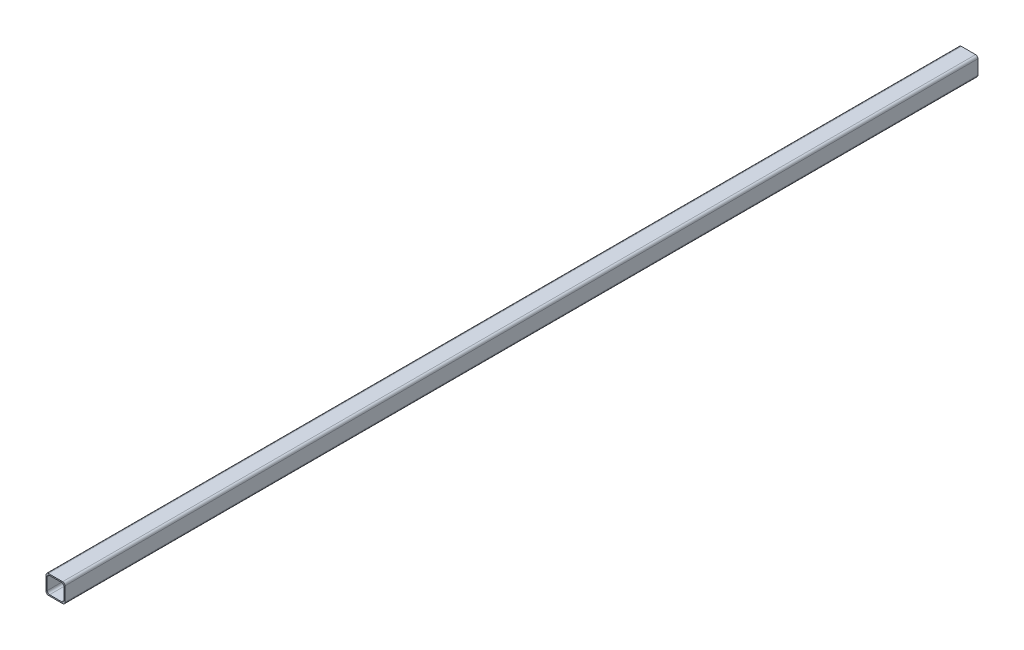
from build123d import *

# Parameters (mm, degrees)
SKETCH1_W           = 25.4
SKETCH1_H           = 25.4
SKETCH1_W_2         = 22.2504
SKETCH1_H_2         = 22.2504
BOSS_EXTRUDE1_DEPTH = 609.6
FILLET1_R           = 3.175


with BuildPart() as part:
    # Sketch1 → Boss-Extrude1 (new, symmetric)
    with BuildSketch(Plane.XY):
        Rectangle(SKETCH1_W, SKETCH1_H)
        Rectangle(SKETCH1_W_2, SKETCH1_H_2, mode=Mode.SUBTRACT)
    extrude(amount=BOSS_EXTRUDE1_DEPTH, both=True)

    # Fillet1
    fillet1_edges = [part.edges().sort_by_distance(p)[0] for p in [
        (11.1252, -11.1252, 0),
        (11.1252, 11.1252, 0),
        (-11.1252, 11.1252, 0),
        (-11.1252, -11.1252, 0),
        (12.7, -12.7, 0),
        (-12.7, -12.7, 0),
        (-12.7, 12.7, 0),
        (12.7, 12.7, 0),
    ]]
    fillet(fillet1_edges, radius=FILLET1_R)


solid = part.part
